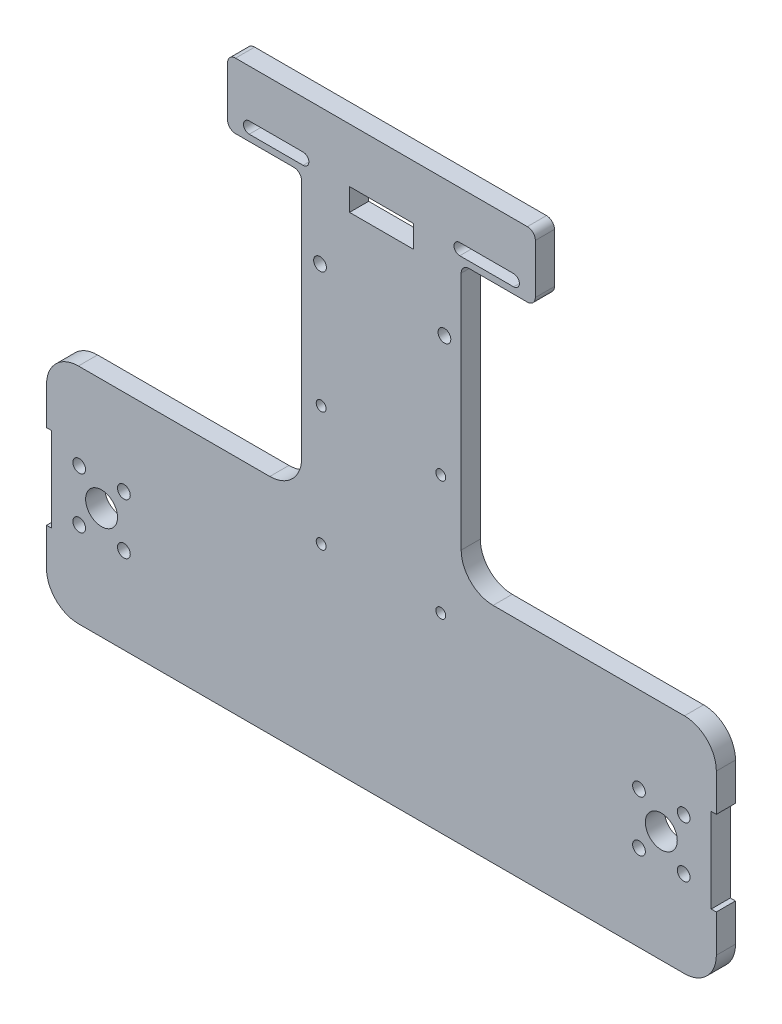
from build123d import *

# Parameters (mm, degrees)
SKETCH1_R           = 2
SKETCH1_R_2         = 5
SKETCH1_R_3         = 1.55
SKETCH1_W           = 20
SKETCH1_H           = 7
BOSS_EXTRUDE1_DEPTH = 6


with BuildPart() as part:
    # Sketch1 → Boss-Extrude1 (new body)
    with BuildSketch(Plane.XY):
        with BuildLine():
            Line((95, -44.105037838), (35, -44.105037838))
            ThreePointArc((35, -44.105037838), (27.928932188, -41.17610565), (25, -34.105037838))
            Line((25, -34.105037838), (25, 41.105037842))
            ThreePointArc((25, 41.105037842), (25.732233047, 42.872804795), (27.5, 43.605037842))
            Line((27.5, 43.605037842), (45.75, 43.605037842))
            ThreePointArc((45.75, 43.605037842), (47.517766953, 44.337270889), (48.25, 46.105037842))
            Line((48.25, 46.105037842), (48.25, 61.605037842))
            ThreePointArc((48.25, 61.605037842), (47.517766953, 63.372804795), (45.75, 64.105037842))
            Line((45.75, 64.105037842), (-45.75, 64.105037842))
            ThreePointArc((-45.75, 64.105037842), (-47.517766953, 63.372804795), (-48.25, 61.605037842))
            Line((-48.25, 61.605037842), (-48.25, 46.105037842))
            ThreePointArc((-48.25, 46.105037842), (-47.517766953, 44.337270889), (-45.75, 43.605037842))
            Line((-45.75, 43.605037842), (-27.5, 43.605037842))
            ThreePointArc((-27.5, 43.605037842), (-25.732233047, 42.872804795), (-25, 41.105037842))
            Line((-25, 41.105037842), (-25, -34.105037838))
            ThreePointArc((-25, -34.105037838), (-27.928932188, -41.17610565), (-35, -44.105037838))
            Line((-35, -44.105037838), (-95, -44.105037838))
            ThreePointArc((-95, -44.105037838), (-102.071067812, -47.033970026), (-105, -54.105037838))
            Line((-105, -54.105037838), (-105, -65.855037838))
            Line((-105, -65.855037838), (-103.4, -65.855037838))
            Line((-103.4, -65.855037838), (-103.4, -92.355037838))
            Line((-103.4, -92.355037838), (-105, -92.355037838))
            Line((-105, -92.355037838), (-105, -104.105037838))
            ThreePointArc((-105, -104.105037838), (-102.071067812, -111.17610565), (-95, -114.105037838))
            Line((-95, -114.105037838), (95, -114.105037838))
            ThreePointArc((95, -114.105037838), (102.071067812, -111.17610565), (105, -104.105037838))
            Line((105, -104.105037838), (105, -92.355037838))
            Line((105, -92.355037838), (103.4, -92.355037838))
            Line((103.4, -92.355037838), (103.4, -65.855037838))
            Line((103.4, -65.855037838), (105, -65.855037838))
            Line((105, -65.855037838), (105, -54.105037838))
            ThreePointArc((105, -54.105037838), (102.071067812, -47.033970026), (95, -44.105037838))
        make_face()
        with Locations((80.75, -87.105037838)):
            Circle(SKETCH1_R, mode=Mode.SUBTRACT)
        with Locations((87.75, -79.105037838)):
            Circle(SKETCH1_R_2, mode=Mode.SUBTRACT)
        with Locations((94.75, -71.105037838)):
            Circle(SKETCH1_R, mode=Mode.SUBTRACT)
        with Locations((80.75, -71.105037838)):
            Circle(SKETCH1_R, mode=Mode.SUBTRACT)
        with Locations((-80.75, -71.105037838)):
            Circle(SKETCH1_R, mode=Mode.SUBTRACT)
        with Locations((-94.75, -71.105037838)):
            Circle(SKETCH1_R, mode=Mode.SUBTRACT)
        with Locations((-87.75, -79.105037838)):
            Circle(SKETCH1_R_2, mode=Mode.SUBTRACT)
        with Locations((-80.75, -87.105037838)):
            Circle(SKETCH1_R, mode=Mode.SUBTRACT)
        with Locations((-18.894331083, -54.378109012)):
            Circle(SKETCH1_R_3, mode=Mode.SUBTRACT)
        with Locations((18.605668917, -16.878109012)):
            Circle(SKETCH1_R_3, mode=Mode.SUBTRACT)
        with Locations((-18.894331083, -16.878109012)):
            Circle(SKETCH1_R_3, mode=Mode.SUBTRACT)
        with Locations((18.605668917, -54.378109012)):
            Circle(SKETCH1_R_3, mode=Mode.SUBTRACT)
        with Locations((19.746744501, 21.488147141)):
            Circle(SKETCH1_R, mode=Mode.SUBTRACT)
        with Locations((-19.253255499, 21.488147141)):
            Circle(SKETCH1_R, mode=Mode.SUBTRACT)
        with Locations((-94.75, -87.105037838)):
            Circle(SKETCH1_R, mode=Mode.SUBTRACT)
        with Locations((94.75, -87.105037838)):
            Circle(SKETCH1_R, mode=Mode.SUBTRACT)
        with BuildLine():
            Line((-41.45, 49.205037842), (-24.55, 49.205037842))
            ThreePointArc((-24.55, 49.205037842), (-22.75, 47.405037842), (-24.55, 45.605037842))
            Line((-24.55, 45.605037842), (-41.45, 45.605037842))
            ThreePointArc((-41.45, 45.605037842), (-43.25, 47.405037842), (-41.45, 49.205037842))
        make_face(mode=Mode.SUBTRACT)
        with BuildLine():
            Line((41.45, 45.605037842), (24.55, 45.605037842))
            ThreePointArc((24.55, 45.605037842), (22.75, 47.405037842), (24.55, 49.205037842))
            Line((24.55, 49.205037842), (41.45, 49.205037842))
            ThreePointArc((41.45, 49.205037842), (43.25, 47.405037842), (41.45, 45.605037842))
        make_face(mode=Mode.SUBTRACT)
        with Locations((0, 43.605037842)):
            Rectangle(SKETCH1_W, SKETCH1_H, mode=Mode.SUBTRACT)
    extrude(amount=BOSS_EXTRUDE1_DEPTH)


solid = part.part
